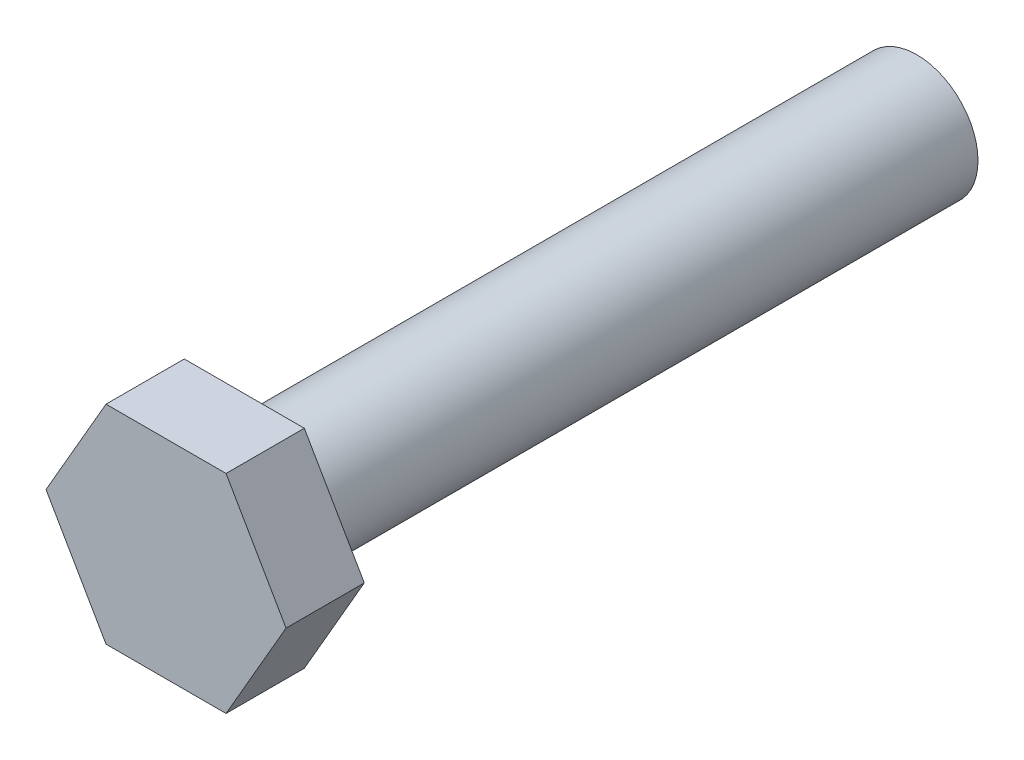
from build123d import *

# Parameters (mm, degrees)
SKETCH1_R      = 5
EXTRUDE1_DEPTH = 55
EXTRUDE2_DEPTH = 6.4


with BuildPart() as part:
    # Sketch1 → Extrude1 (new body)
    with BuildSketch(Plane.XY):
        Circle(SKETCH1_R)
    extrude(amount=-EXTRUDE1_DEPTH)

    # Sketch2 → Extrude2 (add)
    with BuildSketch(Plane.XY):
        Polygon((-4.907477288, 8.5), (-9.814954576, 0), (-4.907477288, -8.5), (4.907477288, -8.5), (9.814954576, 0), (4.907477288, 8.5), align=None)
    extrude(amount=EXTRUDE2_DEPTH)


solid = part.part
